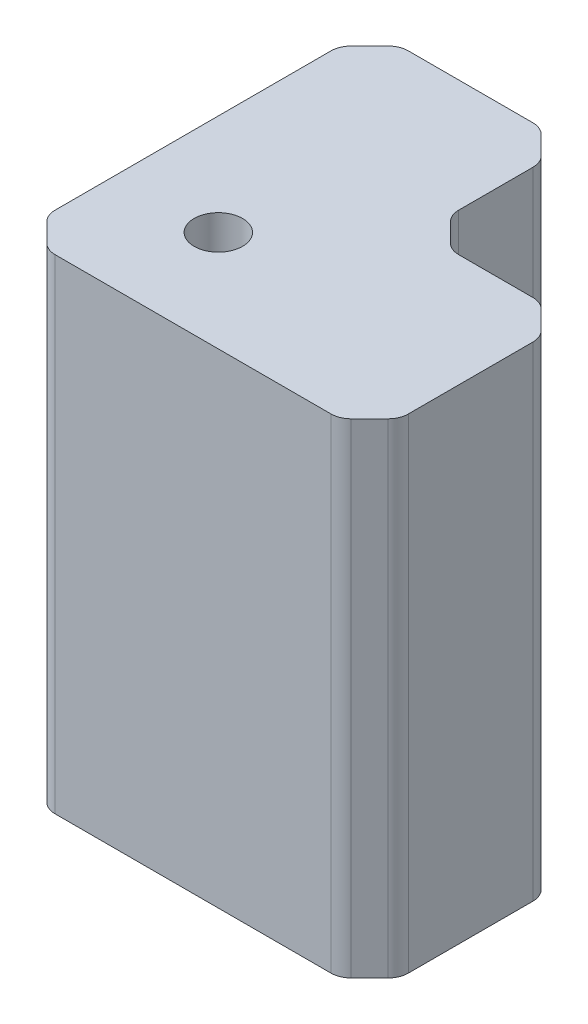
from build123d import *

# Parameters (mm, degrees)
BOSS_EXTRUDE1_DEPTH  = 48
M4_CLEARANCE_HOLE1_D = 4.8
SKETCH4_R            = 5
CUT_EXTRUDE1_DEPTH   = 2
CHAMFER1_SIZE        = 3
FILLET1_R            = 2


with BuildPart() as part:
    # Sketch1 → Boss-Extrude1 (new body)
    with BuildSketch(Plane(origin=(0, 0, 0), x_dir=(1, 0, 0), z_dir=(0, 1, 0))):
        Polygon((-10, 10), (-10, 25), (10, 25), (10, 10), (25, 10), (25, -10), (10, -10), (-10, -10), align=None)
    extrude(amount=BOSS_EXTRUDE1_DEPTH)

    # M4 Clearance Hole1 (through all)
    with Locations(Plane(origin=(0, 48, 0), x_dir=(1, 0, 0), z_dir=(0, 1, 0))):
        with Locations((0, 0)):
            Hole(M4_CLEARANCE_HOLE1_D / 2)

    # Sketch4 → Cut-Extrude1 (cut)
    with BuildSketch(Plane.XZ):
        with Locations(Location((0, 0, 0), (0, 0, 270))):
            Circle(SKETCH4_R)
    extrude(amount=-CUT_EXTRUDE1_DEPTH, mode=Mode.SUBTRACT)

    # Chamfer1
    chamfer1_edges = [part.edges().sort_by_distance(p)[0] for p in [
        (-10, 24, -25),
        (10, 24, -25),
        (10, 24, -10),
        (25, 24, -10),
        (25, 24, 10),
        (-10, 24, 10),
    ]]
    chamfer(chamfer1_edges, length=CHAMFER1_SIZE)

    # Fillet1
    fillet1_edges = [part.edges().sort_by_distance(p)[0] for p in [
        (10, 24, -22),
        (10, 24, -13),
        (22, 24, -10),
        (13, 24, -10),
        (-10, 24, 7),
        (-10, 24, -22),
        (7, 24, -25),
        (-7, 24, -25),
        (25, 24, 7),
        (25, 24, -7),
        (-7, 24, 10),
        (22, 24, 10),
    ]]
    fillet(fillet1_edges, radius=FILLET1_R)


solid = part.part
